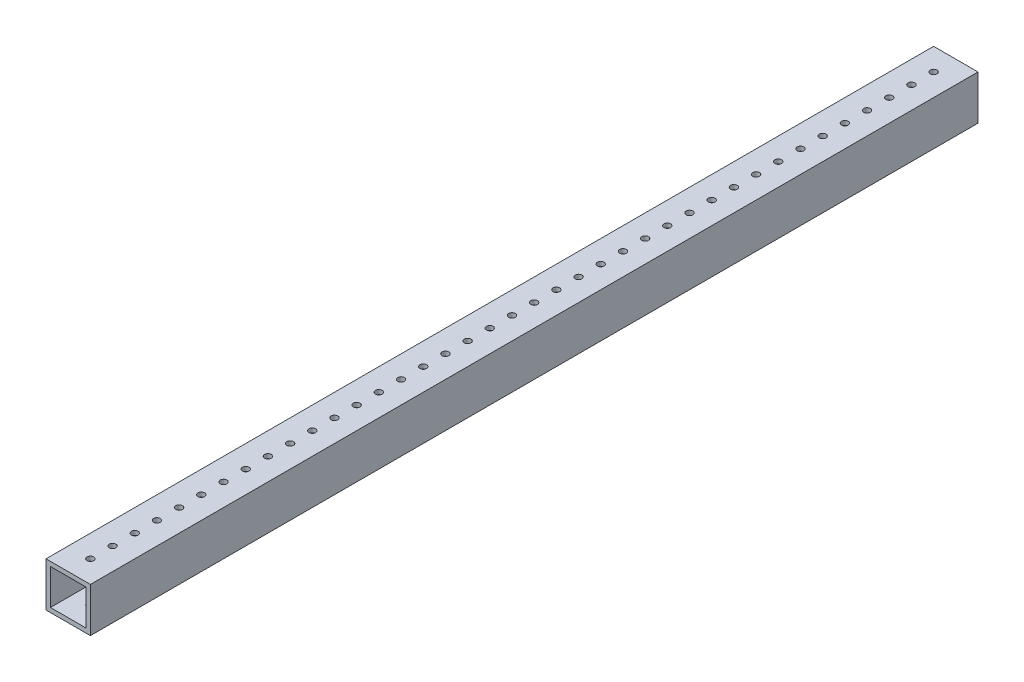
from build123d import *

# Parameters (mm, degrees)
SKETCH_1_W          = 20
SKETCH_1_H          = 20
SKETCH_1_W_2        = 16
SKETCH_1_H_2        = 16
EXTRUDE_1_DEPTH     = 400
SKETCH_9_R          = 1.5
CUT_EXTRUDE_6_DEPTH = 401.998753115


with BuildPart() as part:
    # 草图1 → 凸台-拉伸1 (new body)
    with BuildSketch(Plane.XY):
        with Locations((10, 10)):
            Rectangle(SKETCH_1_W, SKETCH_1_H)
        with Locations((10, 10)):
            Rectangle(SKETCH_1_W_2, SKETCH_1_H_2, mode=Mode.SUBTRACT)
    extrude(amount=EXTRUDE_1_DEPTH)

    # 草图9 → 切除-拉伸6 (cut, through all)
    with BuildSketch(Plane(origin=(0, 20, 0), x_dir=(1, 0, 0), z_dir=(0, 1, 0))):
        with Locations(Location((10, -390, 0), (0, 0, 270))):
            Circle(SKETCH_9_R)
        with Locations(Location((10, -380, 0), (0, 0, 270))):
            Circle(SKETCH_9_R)
        with Locations(Location((10, -370, 0), (0, 0, 270))):
            Circle(SKETCH_9_R)
        with Locations(Location((10, -360, 0), (0, 0, 270))):
            Circle(SKETCH_9_R)
        with Locations(Location((10, -350, 0), (0, 0, 270))):
            Circle(SKETCH_9_R)
        with Locations(Location((10, -340, 0), (0, 0, 270))):
            Circle(SKETCH_9_R)
        with Locations(Location((10, -330, 0), (0, 0, 270))):
            Circle(SKETCH_9_R)
        with Locations(Location((10, -320, 0), (0, 0, 270))):
            Circle(SKETCH_9_R)
        with Locations(Location((10, -310, 0), (0, 0, 270))):
            Circle(SKETCH_9_R)
        with Locations(Location((10, -300, 0), (0, 0, 270))):
            Circle(SKETCH_9_R)
        with Locations(Location((10, -290, 0), (0, 0, 270))):
            Circle(SKETCH_9_R)
        with Locations(Location((10, -280, 0), (0, 0, 270))):
            Circle(SKETCH_9_R)
        with Locations(Location((10, -270, 0), (0, 0, 270))):
            Circle(SKETCH_9_R)
        with Locations(Location((10, -260, 0), (0, 0, 270))):
            Circle(SKETCH_9_R)
        with Locations(Location((10, -250, 0), (0, 0, 270))):
            Circle(SKETCH_9_R)
        with Locations(Location((10, -240, 0), (0, 0, 270))):
            Circle(SKETCH_9_R)
        with Locations(Location((10, -230, 0), (0, 0, 270))):
            Circle(SKETCH_9_R)
        with Locations(Location((10, -220, 0), (0, 0, 270))):
            Circle(SKETCH_9_R)
        with Locations(Location((10, -210, 0), (0, 0, 270))):
            Circle(SKETCH_9_R)
        with Locations(Location((10, -200, 0), (0, 0, 270))):
            Circle(SKETCH_9_R)
        with Locations(Location((10, -190, 0), (0, 0, 270))):
            Circle(SKETCH_9_R)
        with Locations(Location((10, -180, 0), (0, 0, 270))):
            Circle(SKETCH_9_R)
        with Locations(Location((10, -170, 0), (0, 0, 270))):
            Circle(SKETCH_9_R)
        with Locations(Location((10, -160, 0), (0, 0, 270))):
            Circle(SKETCH_9_R)
        with Locations(Location((10, -150, 0), (0, 0, 270))):
            Circle(SKETCH_9_R)
        with Locations(Location((10, -140, 0), (0, 0, 270))):
            Circle(SKETCH_9_R)
        with Locations(Location((10, -130, 0), (0, 0, 270))):
            Circle(SKETCH_9_R)
        with Locations(Location((10, -120, 0), (0, 0, 270))):
            Circle(SKETCH_9_R)
        with Locations(Location((10, -110, 0), (0, 0, 270))):
            Circle(SKETCH_9_R)
        with Locations(Location((10, -100, 0), (0, 0, 270))):
            Circle(SKETCH_9_R)
        with Locations(Location((10, -90, 0), (0, 0, 270))):
            Circle(SKETCH_9_R)
        with Locations(Location((10, -80, 0), (0, 0, 270))):
            Circle(SKETCH_9_R)
        with Locations(Location((10, -70, 0), (0, 0, 270))):
            Circle(SKETCH_9_R)
        with Locations(Location((10, -60, 0), (0, 0, 270))):
            Circle(SKETCH_9_R)
        with Locations(Location((10, -50, 0), (0, 0, 270))):
            Circle(SKETCH_9_R)
        with Locations(Location((10, -40, 0), (0, 0, 270))):
            Circle(SKETCH_9_R)
        with Locations(Location((10, -30, 0), (0, 0, 270))):
            Circle(SKETCH_9_R)
        with Locations(Location((10, -20, 0), (0, 0, 270))):
            Circle(SKETCH_9_R)
        with Locations(Location((10, -10, 0), (0, 0, 270))):
            Circle(SKETCH_9_R)
    extrude(amount=-CUT_EXTRUDE_6_DEPTH, mode=Mode.SUBTRACT)


solid = part.part
